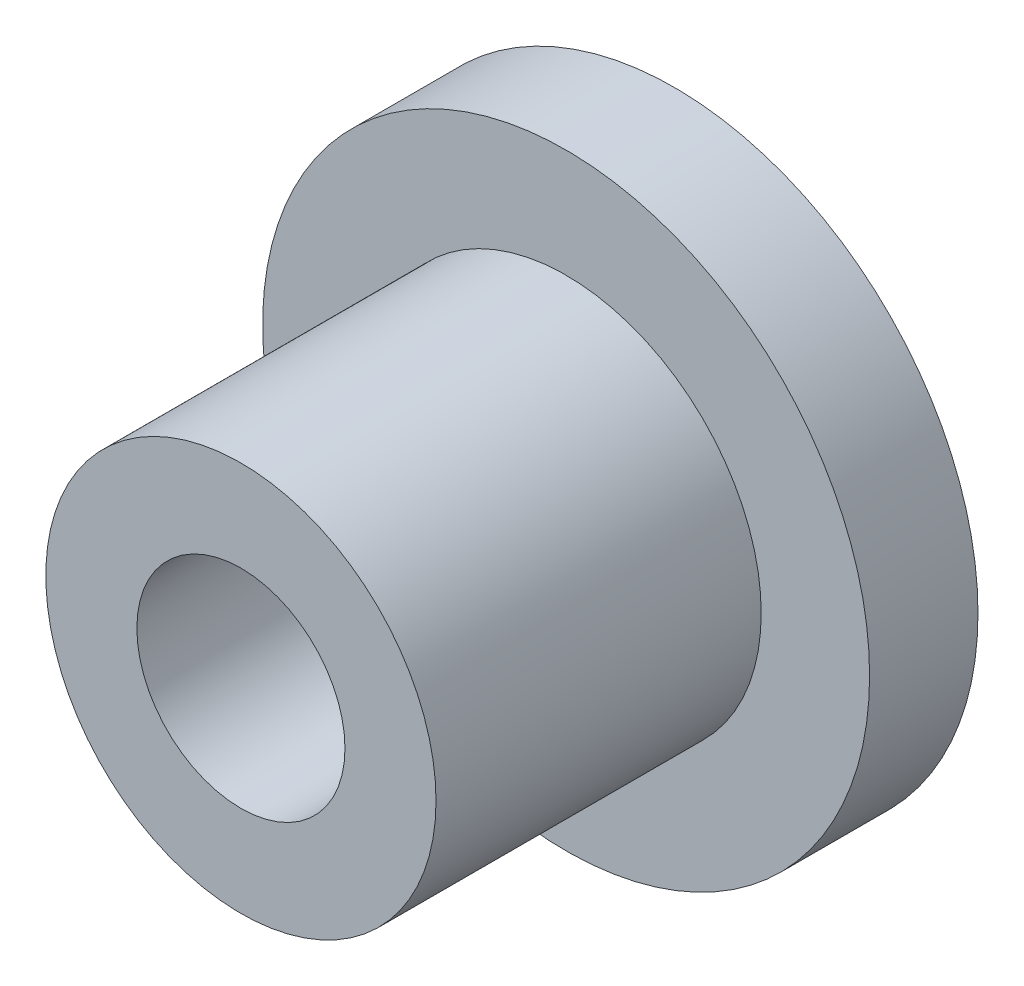
from build123d import *

# Parameters (mm, degrees)
SKETCH1_R           = 7
BOSS_EXTRUDE1_DEPTH = 2.5
SKETCH2_R           = 4.5
BOSS_EXTRUDE2_DEPTH = 7.5
SKETCH3_R           = 2.4
CUT_EXTRUDE1_DEPTH  = 5


with BuildPart() as part:
    # Sketch1 → Boss-Extrude1 (new body)
    with BuildSketch(Plane.XY):
        Circle(SKETCH1_R)
    extrude(amount=BOSS_EXTRUDE1_DEPTH)

    # Sketch2 → Boss-Extrude2 (add)
    with BuildSketch(Plane.XY.offset(2.5)):
        Circle(SKETCH2_R)
    extrude(amount=BOSS_EXTRUDE2_DEPTH)

    # Sketch3 → Cut-Extrude1 (cut)
    with BuildSketch(Plane.XY.offset(10)):
        Circle(SKETCH3_R)
    extrude(amount=-CUT_EXTRUDE1_DEPTH, mode=Mode.SUBTRACT)


solid = part.part
